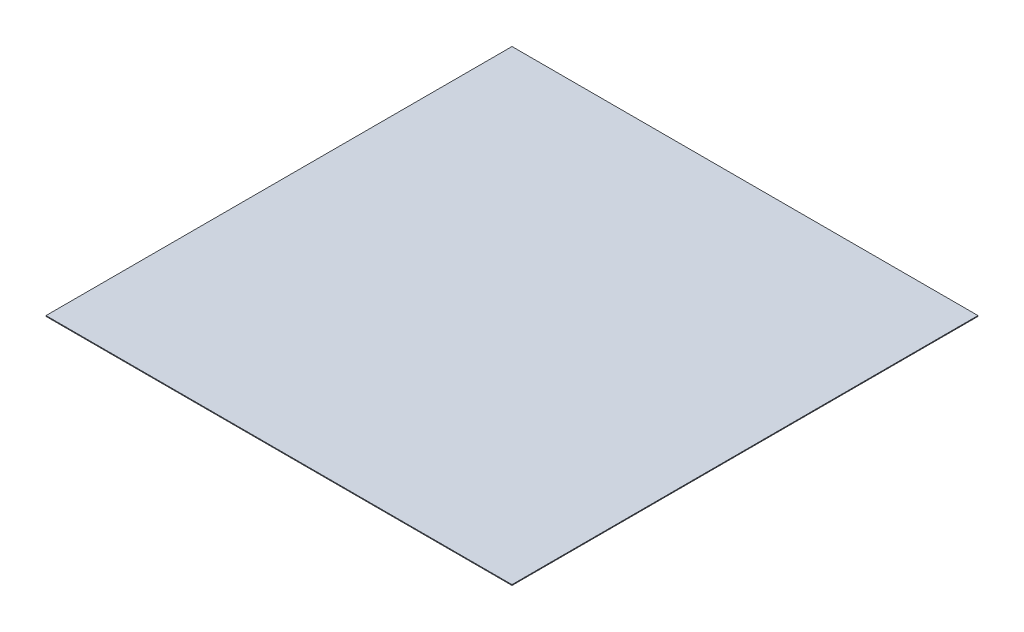
from build123d import *

# Parameters (mm, degrees)
SKETCH1_W        = 30480
SKETCH1_H        = 30480
EXTRUSION1_DEPTH = 50.8


with BuildPart() as part:
    # Sketch1 → Extrusion1 (new body)
    with BuildSketch(Plane(origin=(0, 0, 0), x_dir=(-1, 0, 0), z_dir=(0, 1, 0))):
        with Locations((-15240, -15240)):
            Rectangle(SKETCH1_W, SKETCH1_H)
    extrude(amount=EXTRUSION1_DEPTH)


solid = part.part
